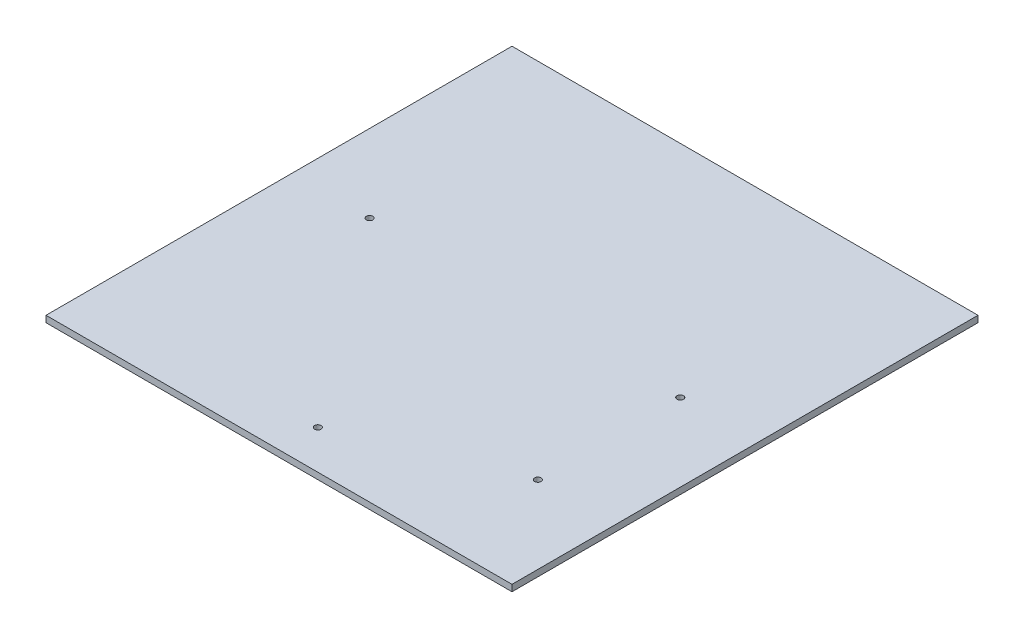
from build123d import *

# Parameters (mm, degrees)
SKETCH1_W          = 914.4
SKETCH1_H          = 914.4
BASE_PLATE_DEPTH   = 12.7
SKETCH2_R          = 6.35
CENTER_HOLES_DEPTH = 647.703154469


with BuildPart() as part:
    # Sketch1 → Base_Plate (new body)
    with BuildSketch(Plane(origin=(0, 0, 0), x_dir=(1, 0, 0), z_dir=(0, 1, 0))):
        Rectangle(SKETCH1_W, SKETCH1_H)
    extrude(amount=BASE_PLATE_DEPTH)

    # Sketch2 → Center_Holes (cut, through all)
    with BuildSketch(Plane(origin=(0, 12.7, 0), x_dir=(1, 0, 0), z_dir=(0, 1, 0))):
        with Locations(Location((0, -381, 0), (0, 0, 270))):
            Circle(SKETCH2_R)
        with Locations(Location((304.8, -254, 0), (0, 0, 270))):
            Circle(SKETCH2_R)
        with Locations(Location((304.8, 25.4, 0), (0, 0, 270))):
            Circle(SKETCH2_R)
        with Locations(Location((-304.8, 25.4, 0), (0, 0, 270))):
            Circle(SKETCH2_R)
    extrude(amount=-CENTER_HOLES_DEPTH, mode=Mode.SUBTRACT)


solid = part.part
